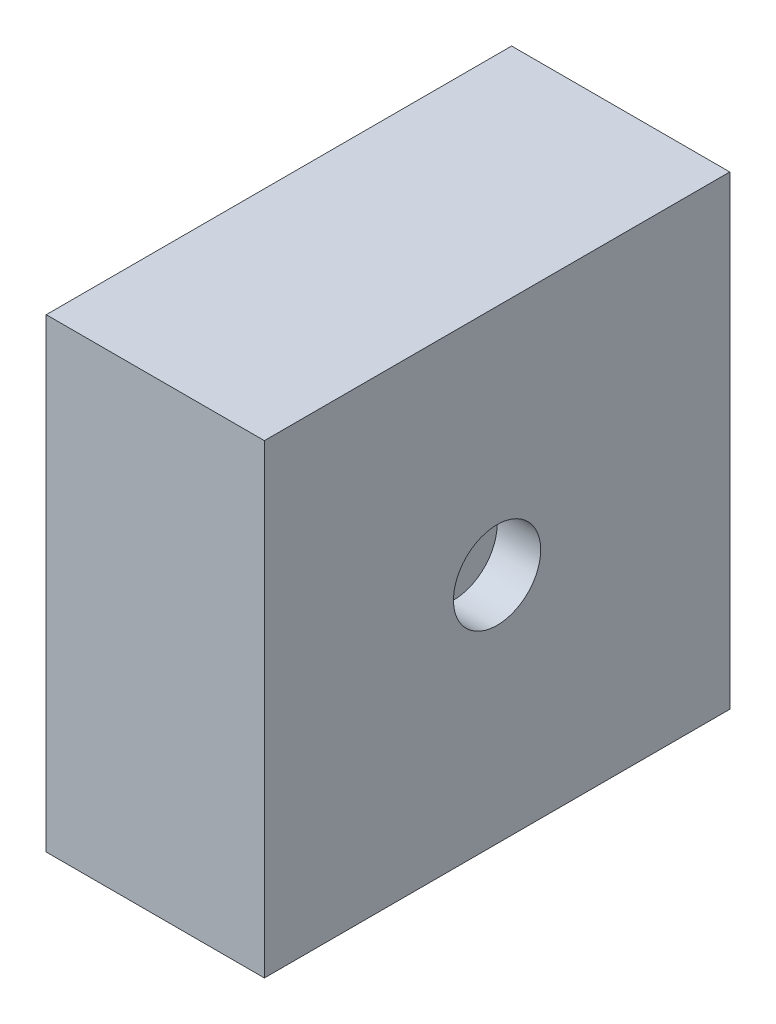
from build123d import *

# Parameters (mm, degrees)
SKETCH2_W           = 32
SKETCH2_H           = 32
BOSS_EXTRUDE1_DEPTH = 15
SKETCH3_R           = 3
CUT_EXTRUDE1_DEPTH  = 3


with BuildPart() as part:
    # Sketch2 → Boss-Extrude1 (new body)
    with BuildSketch(Plane(origin=(0, 0, 0), x_dir=(0, 0, -1), z_dir=(1, 0, 0))):
        with Locations((-16, -16)):
            Rectangle(SKETCH2_W, SKETCH2_H)
    extrude(amount=BOSS_EXTRUDE1_DEPTH)

    # Sketch3 → Cut-Extrude1 (cut)
    with BuildSketch(Plane(origin=(15, 0, 0), x_dir=(0, 0, -1), z_dir=(1, 0, 0))):
        with Locations((-16, -16)):
            Circle(SKETCH3_R)
    extrude(amount=-CUT_EXTRUDE1_DEPTH, mode=Mode.SUBTRACT)


solid = part.part
